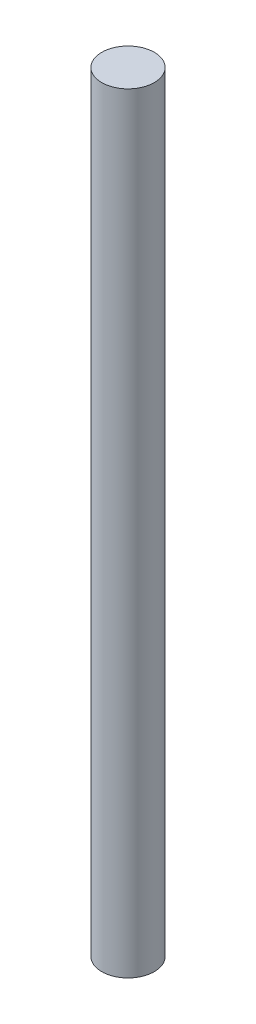
from build123d import *

# Parameters (mm, degrees)
SKETCH1_R           = 1.3
BOSS_EXTRUDE1_DEPTH = 38.1


with BuildPart() as part:
    # Sketch1 → Boss-Extrude1 (new body)
    with BuildSketch(Plane(origin=(0, 0, 0), x_dir=(1, 0, 0), z_dir=(0, 1, 0))):
        with Locations(Location((0, 0, 0), (0, 0, 90))):
            Circle(SKETCH1_R)
    extrude(amount=BOSS_EXTRUDE1_DEPTH)


solid = part.part
